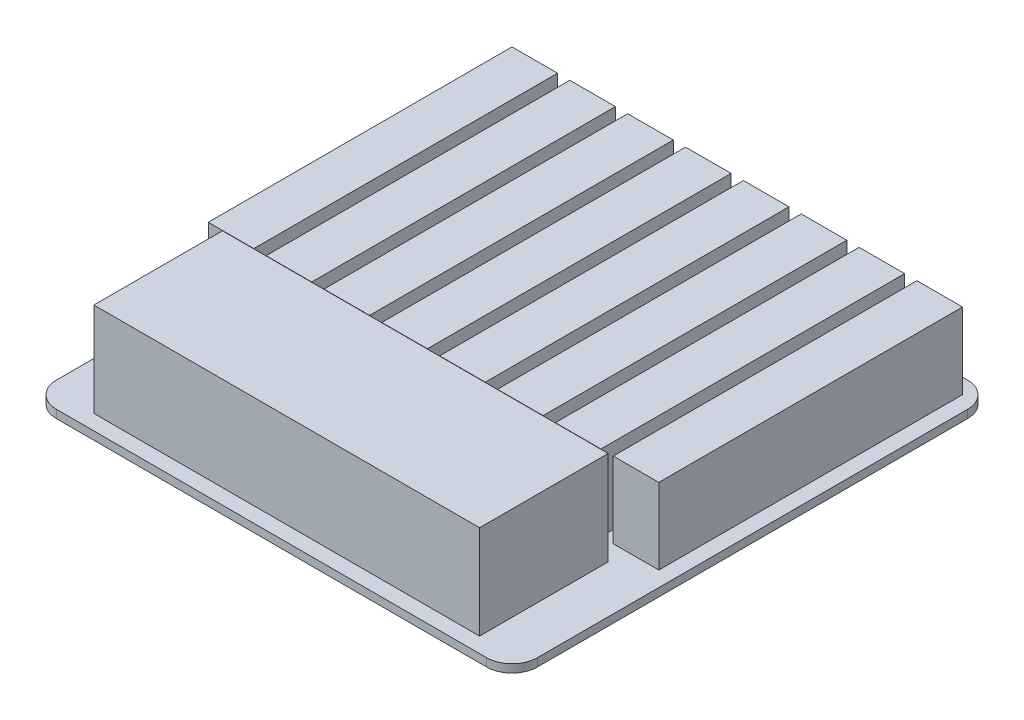
from build123d import *

# Parameters (mm, degrees)
SKETCH1_W           = 95
SKETCH1_H           = 95
BOSS_EXTRUDE1_DEPTH = 0.8
FILLET1_R           = 5
SKETCH2_W           = 76.2
SKETCH2_H           = 25.4
BOSS_EXTRUDE2_DEPTH = 18.542
SKETCH3_W           = 9
SKETCH3_H           = 60
BOSS_EXTRUDE3_DEPTH = 15


with BuildPart() as part:
    # Sketch1 → Boss-Extrude1 (new, symmetric)
    with BuildSketch(Plane(origin=(0, 0, 0), x_dir=(1, 0, 0), z_dir=(0, 1, 0))):
        Rectangle(SKETCH1_W, SKETCH1_H)
    extrude(amount=BOSS_EXTRUDE1_DEPTH, both=True)

    # Fillet1
    fillet1_edges = [part.edges().sort_by_distance(p)[0] for p in [
        (47.5, 0, 47.5),
        (-47.5, 0, 47.5),
        (-47.5, 0, -47.5),
        (47.5, 0, -47.5),
    ]]
    fillet(fillet1_edges, radius=FILLET1_R)

    # Sketch2 → Boss-Extrude2 (add)
    with BuildSketch(Plane(origin=(0, 0.8, 0), x_dir=(1, 0, 0), z_dir=(0, 1, 0))):
        with Locations((0, -31.8)):
            Rectangle(SKETCH2_W, SKETCH2_H)
    extrude(amount=BOSS_EXTRUDE2_DEPTH)

    # Sketch3 → Boss-Extrude3 (add)
    with BuildSketch(Plane(origin=(0, 0.8, 0), x_dir=(1, 0, 0), z_dir=(0, 1, 0))):
        with Locations((-40, 14.5)):
            Rectangle(SKETCH3_W, SKETCH3_H)
        with Locations((-28.571428571, 14.5)):
            Rectangle(SKETCH3_W, SKETCH3_H)
        with Locations((-17.142857143, 14.5)):
            Rectangle(SKETCH3_W, SKETCH3_H)
        with Locations((-5.714285714, 14.5)):
            Rectangle(SKETCH3_W, SKETCH3_H)
        with Locations((5.714285714, 14.5)):
            Rectangle(SKETCH3_W, SKETCH3_H)
        with Locations((17.142857143, 14.5)):
            Rectangle(SKETCH3_W, SKETCH3_H)
        with Locations((28.571428571, 14.5)):
            Rectangle(SKETCH3_W, SKETCH3_H)
        with Locations((40, 14.5)):
            Rectangle(SKETCH3_W, SKETCH3_H)
    extrude(amount=BOSS_EXTRUDE3_DEPTH)


solid = part.part
